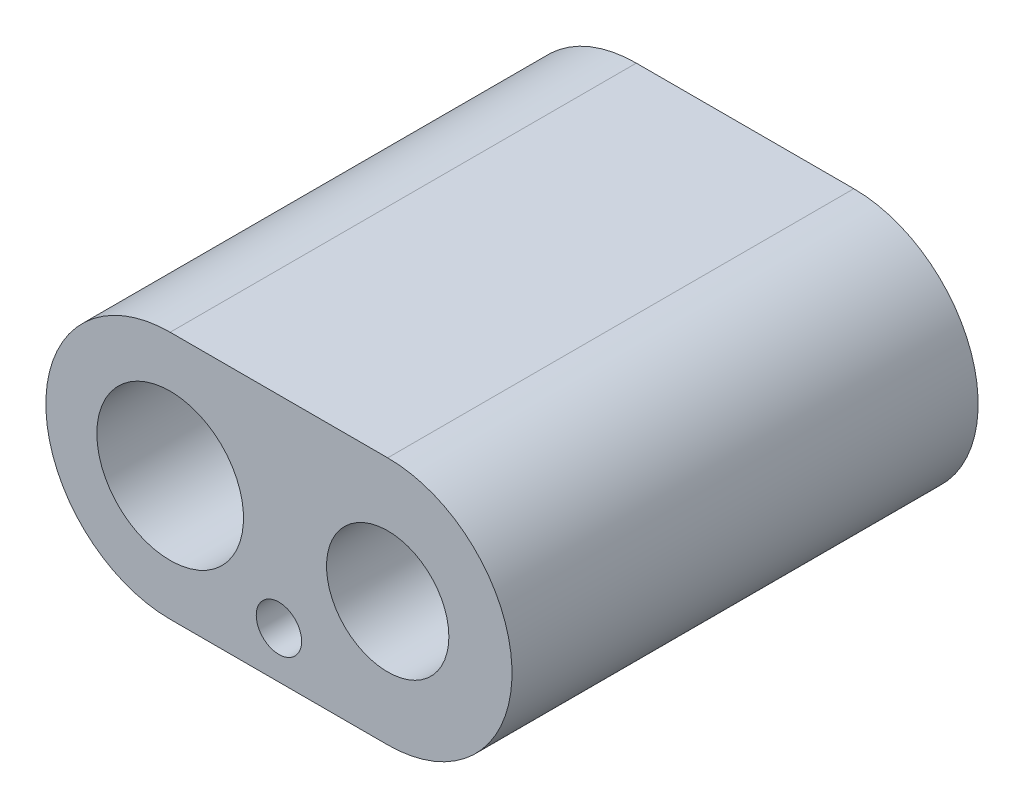
from build123d import *

# Parameters (mm, degrees)
SKETCH1_R           = 2.9972
SKETCH1_R_2         = 1.5875
SKETCH1_R_3         = 0.9271
BOSS_EXTRUDE1_DEPTH = 19.05
SKETCH2_R           = 2.5
CUT_EXTRUDE1_DEPTH  = 5


with BuildPart() as part:
    # Sketch1 → Boss-Extrude1 (new body)
    with BuildSketch(Plane.XY):
        with BuildLine():
            Line((0, 5.08), (8.89, 5.08))
            ThreePointArc((8.89, 5.08), (13.97, 0), (8.89, -5.08))
            Line((8.89, -5.08), (0, -5.08))
            ThreePointArc((0, -5.08), (-5.08, 0), (0, 5.08))
        make_face()
        with Locations(Location((0, 0, 0), (0, 0, 180))):
            Circle(SKETCH1_R, mode=Mode.SUBTRACT)
        with Locations(Location((8.89, 0, 0), (0, 0, 180))):
            Circle(SKETCH1_R_2, mode=Mode.SUBTRACT)
        with Locations(Location((4.445, -3.175, 0), (0, 0, 180))):
            Circle(SKETCH1_R_3, mode=Mode.SUBTRACT)
    extrude(amount=BOSS_EXTRUDE1_DEPTH)

    # Sketch2 → Cut-Extrude1 (cut)
    with BuildSketch(Plane.XY.offset(19.05)):
        with Locations((8.89, 0)):
            Circle(SKETCH2_R)
    extrude(amount=-CUT_EXTRUDE1_DEPTH, mode=Mode.SUBTRACT)

    # Sketch3 → Cut-Revolve1 (revolve, cut)
    with BuildSketch(Plane(origin=(0, 0, 0), x_dir=(1, 0, 0), z_dir=(0, 1, 0)), mode=Mode.PRIVATE) as cut_revolve1_sk:
        Polygon((11.39, -14.05), (10.4775, -13.501714685), (10.4775, -14.05), align=None)
    revolve(cut_revolve1_sk.sketch.rotate(Axis((8.89, 0, 14.05), (0, 0, 1)), 180), axis=Axis((8.89, 0, 14.05), (0, 0, 1)), mode=Mode.SUBTRACT)


solid = part.part
